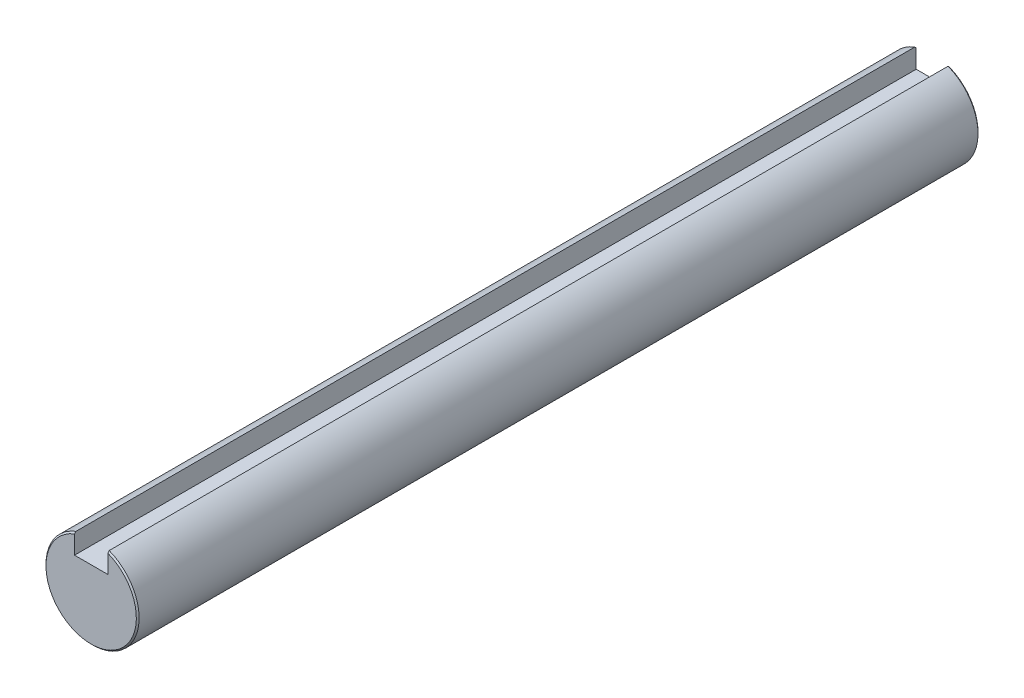
from build123d import *

# Parameters (mm, degrees)
BOSS_EXTRUDE1_DEPTH      = 63.25
BOSS_EXTRUDE1_DEPTH_BACK = 63.25
CHAMFER1_SIZE            = 0.21


with BuildPart() as part:
    # Sketch3 → Boss-Extrude1 (new, two sides: drawn at the far end of the back side and taken through both)
    with BuildSketch(Plane.XY.offset(-BOSS_EXTRUDE1_DEPTH_BACK)):
        with BuildLine():
            Line((-2.5, 3.538348415), (-2.5, 6.538348415))
            ThreePointArc((-2.5, 6.538348415), (0, -7), (2.5, 6.538348415))
            Line((2.5, 6.538348415), (2.5, 3.538348415))
            Line((2.5, 3.538348415), (-2.5, 3.538348415))
        make_face()
    extrude(amount=BOSS_EXTRUDE1_DEPTH + BOSS_EXTRUDE1_DEPTH_BACK)

    # Chamfer1
    chamfer1_edges = [part.edges().sort_by_distance(p)[0] for p in [
        (0, -7, -63.25),
        (0, -7, 63.25),
    ]]
    chamfer(chamfer1_edges, length=CHAMFER1_SIZE)


solid = part.part
